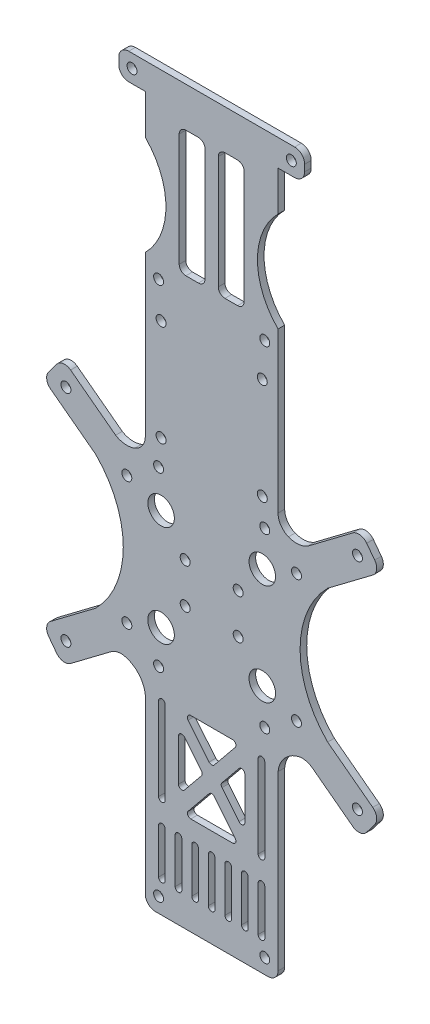
from build123d import *

# Parameters (mm, degrees)
CROQUIS1_R              = 4
CROQUIS1_R_2            = 1.5
SALIENTE_EXTRUIR1_DEPTH = 2
REDONDEO2_R             = 3
REDONDEO3_R             = 5
CROQUIS5_R              = 1.5
SALIENTE_EXTRUIR2_DEPTH = 2
CORTAR_EXTRUIR1_DEPTH   = 2


with BuildPart() as part:
    # Croquis1 → Saliente-Extruir1 (new body)
    with BuildSketch(Plane.XY):
        with BuildLine():
            Line((20, 130.25), (-20, 130.25))
            Line((-20, 130.25), (-20, 30.25))
            ThreePointArc((-20, 30.25), (-24.015805554, 27.30711153), (-28.936345286, 28.065778476))
            Line((-28.936345286, 28.065778476), (-44.909055487, 40.102078939))
            Line((-44.909055487, 40.102078939), (-47.918130603, 36.108901389))
            Line((-47.918130603, 36.108901389), (-50.927205719, 32.115723839))
            Line((-50.927205719, 32.115723839), (-34.954495518, 20.079423376))
            ThreePointArc((-34.954495518, 20.079423376), (-26.637326031, 0), (-34.954495518, -20.079423376))
            Line((-34.954495518, -20.079423376), (-50.927205719, -32.115723839))
            Line((-50.927205719, -32.115723839), (-47.918130603, -36.108901389))
            Line((-47.918130603, -36.108901389), (-44.909055487, -40.102078939))
            Line((-44.909055487, -40.102078939), (-28.936345286, -28.065778476))
            ThreePointArc((-28.936345286, -28.065778476), (-22.980271648, -29.80711153), (-20, -35.25))
            Line((-20, -35.25), (-20, -90.25))
            Line((-20, -90.25), (20, -90.25))
            Line((20, -90.25), (20, -35.25))
            ThreePointArc((20, -35.25), (22.980271648, -29.80711153), (28.936345286, -28.065778476))
            Line((28.936345286, -28.065778476), (44.909055487, -40.102078939))
            Line((44.909055487, -40.102078939), (47.918130603, -36.108901389))
            Line((47.918130603, -36.108901389), (50.927205719, -32.115723839))
            Line((50.927205719, -32.115723839), (34.954495518, -20.079423376))
            ThreePointArc((34.954495518, -20.079423376), (26.637326031, 0), (34.954495518, 20.079423376))
            Line((34.954495518, 20.079423376), (50.927205719, 32.115723839))
            Line((50.927205719, 32.115723839), (47.918130603, 36.108901389))
            Line((47.918130603, 36.108901389), (44.909055487, 40.102078939))
            Line((44.909055487, 40.102078939), (28.936345286, 28.065778476))
            ThreePointArc((28.936345286, 28.065778476), (24.015805554, 27.30711153), (20, 30.25))
            Line((20, 30.25), (20, 130.25))
        make_face()
        with Locations((-15.25, 15.25)):
            Circle(CROQUIS1_R, mode=Mode.SUBTRACT)
        with Locations((-15.25, -15.25)):
            Circle(CROQUIS1_R, mode=Mode.SUBTRACT)
        with Locations(Location((15.25, -15.25, 0), (0, 0, 180))):
            Circle(CROQUIS1_R, mode=Mode.SUBTRACT)
        with Locations(Location((15.25, 15.25, 0), (0, 0, 180))):
            Circle(CROQUIS1_R, mode=Mode.SUBTRACT)
        with Locations((-43.924953053, 33.099826273)):
            Circle(CROQUIS1_R_2, mode=Mode.SUBTRACT)
        with Locations((-43.924953053, -33.099826273)):
            Circle(CROQUIS1_R_2, mode=Mode.SUBTRACT)
        with Locations(Location((43.924953053, -33.099826273, 0), (0, 0, 180))):
            Circle(CROQUIS1_R_2, mode=Mode.SUBTRACT)
        with Locations(Location((43.924953053, 33.099826273, 0), (0, 0, 180))):
            Circle(CROQUIS1_R_2, mode=Mode.SUBTRACT)
        with Locations((-7.9863551, 6.018150232)):
            Circle(CROQUIS1_R_2, mode=Mode.SUBTRACT)
        with Locations((-25.560283405, 19.261055082)):
            Circle(CROQUIS1_R_2, mode=Mode.SUBTRACT)
        with Locations((-25.560283405, -19.261055082)):
            Circle(CROQUIS1_R_2, mode=Mode.SUBTRACT)
        with Locations((-7.9863551, -6.018150232)):
            Circle(CROQUIS1_R_2, mode=Mode.SUBTRACT)
        with Locations(Location((25.560283405, -19.261055082, 0), (0, 0, 180))):
            Circle(CROQUIS1_R_2, mode=Mode.SUBTRACT)
        with Locations(Location((7.9863551, -6.018150232, 0), (0, 0, 180))):
            Circle(CROQUIS1_R_2, mode=Mode.SUBTRACT)
        with Locations(Location((7.9863551, 6.018150232, 0), (0, 0, 180))):
            Circle(CROQUIS1_R_2, mode=Mode.SUBTRACT)
        with Locations(Location((25.560283405, 19.261055082, 0), (0, 0, 180))):
            Circle(CROQUIS1_R_2, mode=Mode.SUBTRACT)
        with Locations((-16, -85.75)):
            Circle(CROQUIS1_R_2, mode=Mode.SUBTRACT)
        with Locations((-16, -25.75)):
            Circle(CROQUIS1_R_2, mode=Mode.SUBTRACT)
        with Locations((-16, 26.25)):
            Circle(CROQUIS1_R_2, mode=Mode.SUBTRACT)
        with Locations((-16, 75.25)):
            Circle(CROQUIS1_R_2, mode=Mode.SUBTRACT)
        with Locations(Location((16, -85.75, 0), (0, 0, 180))):
            Circle(CROQUIS1_R_2, mode=Mode.SUBTRACT)
        with Locations(Location((16, -25.75, 0), (0, 0, 180))):
            Circle(CROQUIS1_R_2, mode=Mode.SUBTRACT)
        with Locations(Location((16, 26.25, 0), (0, 0, 180))):
            Circle(CROQUIS1_R_2, mode=Mode.SUBTRACT)
        with Locations(Location((16, 75.25, 0), (0, 0, 180))):
            Circle(CROQUIS1_R_2, mode=Mode.SUBTRACT)
        with Locations((-15.25, 64.75)):
            Circle(CROQUIS1_R_2, mode=Mode.SUBTRACT)
        with Locations((15.25, 64.75)):
            Circle(CROQUIS1_R_2, mode=Mode.SUBTRACT)
        with Locations((15.25, 34.25)):
            Circle(CROQUIS1_R_2, mode=Mode.SUBTRACT)
        with Locations((-15.25, 34.25)):
            Circle(CROQUIS1_R_2, mode=Mode.SUBTRACT)
        with BuildLine():
            Line((-11, -67.25), (-11, -80.75))
            ThreePointArc((-11, -80.75), (-10, -81.75), (-9, -80.75))
            Line((-9, -80.75), (-9, -67.25))
            ThreePointArc((-9, -67.25), (-10, -66.25), (-11, -67.25))
        make_face(mode=Mode.SUBTRACT)
        with BuildLine():
            Line((-16, -67.25), (-16, -80.75))
            ThreePointArc((-16, -80.75), (-15, -81.75), (-14, -80.75))
            Line((-14, -80.75), (-14, -67.25))
            ThreePointArc((-14, -67.25), (-15, -66.25), (-16, -67.25))
        make_face(mode=Mode.SUBTRACT)
        with BuildLine():
            Line((-6, -67.25), (-6, -80.75))
            ThreePointArc((-6, -80.75), (-5, -81.75), (-4, -80.75))
            Line((-4, -80.75), (-4, -67.25))
            ThreePointArc((-4, -67.25), (-5, -66.25), (-6, -67.25))
        make_face(mode=Mode.SUBTRACT)
        with BuildLine():
            Line((-1, -67.25), (-1, -80.75))
            ThreePointArc((-1, -80.75), (0, -81.75), (1, -80.75))
            Line((1, -80.75), (1, -67.25))
            ThreePointArc((1, -67.25), (0, -66.25), (-1, -67.25))
        make_face(mode=Mode.SUBTRACT)
        with BuildLine():
            Line((4, -67.25), (4, -80.75))
            ThreePointArc((4, -80.75), (5, -81.75), (6, -80.75))
            Line((6, -80.75), (6, -67.25))
            ThreePointArc((6, -67.25), (5, -66.25), (4, -67.25))
        make_face(mode=Mode.SUBTRACT)
        with BuildLine():
            Line((9, -67.25), (9, -80.75))
            ThreePointArc((9, -80.75), (10, -81.75), (11, -80.75))
            Line((11, -80.75), (11, -67.25))
            ThreePointArc((11, -67.25), (10, -66.25), (9, -67.25))
        make_face(mode=Mode.SUBTRACT)
        with BuildLine():
            Line((14, -67.25), (14, -80.75))
            ThreePointArc((14, -80.75), (15, -81.75), (16, -80.75))
            Line((16, -80.75), (16, -67.25))
            ThreePointArc((16, -67.25), (15, -66.25), (14, -67.25))
        make_face(mode=Mode.SUBTRACT)
        with BuildLine():
            Line((14, -34.75), (14, -59.75))
            ThreePointArc((14, -59.75), (15, -60.75), (16, -59.75))
            Line((16, -59.75), (16, -34.75))
            ThreePointArc((16, -34.75), (15, -33.75), (14, -34.75))
        make_face(mode=Mode.SUBTRACT)
        with BuildLine():
            Line((-16, -34.75), (-16, -59.75))
            ThreePointArc((-16, -59.75), (-15, -60.75), (-14, -59.75))
            Line((-14, -59.75), (-14, -34.75))
            ThreePointArc((-14, -34.75), (-15, -33.75), (-16, -34.75))
        make_face(mode=Mode.SUBTRACT)
    extrude(amount=SALIENTE_EXTRUIR1_DEPTH)

    # Redondeo2
    redondeo2_edges = [part.edges().sort_by_distance(p)[0] for p in [
        (44.909055487, 40.102078939, 1),
        (50.927205719, 32.115723839, 1),
        (50.927205719, -32.115723839, 1),
        (44.909055487, -40.102078939, 1),
        (20, -90.25, 1),
        (-20, -90.25, 1),
        (-44.909055487, -40.102078939, 1),
        (-50.927205719, -32.115723839, 1),
        (-50.927205719, 32.115723839, 1),
        (-44.909055487, 40.102078939, 1),
    ]]
    fillet(redondeo2_edges, radius=REDONDEO2_R)

    # Redondeo3
    redondeo3_edges = [part.edges().sort_by_distance(p)[0] for p in [
        (20, 30.25, 1),
        (28.936345286, -28.065778476, 1),
        (-28.936345286, -28.065778476, 1),
        (-20, 30.25, 1),
    ]]
    fillet(redondeo3_edges, radius=REDONDEO3_R)

    # Croquis5 → Saliente-Extruir2 (add)
    # profile 1 of 2: a face of its own
    with BuildSketch(Plane.XY.offset(2)):
        with BuildLine():
            Line((-20, 130.25), (-25, 130.25))
            ThreePointArc((-25, 130.25), (-27.121320344, 129.371320344), (-28, 127.25))
            Line((-28, 127.25), (-28, 125.25))
            ThreePointArc((-28, 125.25), (-27.121320344, 123.128679656), (-25, 122.25))
            Line((-25, 122.25), (-20, 122.25))
            Line((-20, 122.25), (-20, 130.25))
        make_face()
        with Locations((-24, 126.25)):
            Circle(CROQUIS5_R, mode=Mode.SUBTRACT)
    # profile 2 of 2: a face of its own
    with BuildSketch(Plane.XY.offset(2)):
        with BuildLine():
            Line((28, 127.25), (28, 125.25))
            ThreePointArc((28, 125.25), (27.121320344, 123.128679656), (25, 122.25))
            Line((25, 122.25), (20, 122.25))
            Line((20, 122.25), (20, 130.25))
            Line((20, 130.25), (25, 130.25))
            ThreePointArc((25, 130.25), (27.121320344, 129.371320344), (28, 127.25))
        make_face()
        with Locations(Location((24, 126.25, 0), (0, 0, 180))):
            Circle(CROQUIS5_R, mode=Mode.SUBTRACT)
    extrude(amount=-SALIENTE_EXTRUIR2_DEPTH)

    # Croquis6 → Cortar-Extruir1 (cut)
    with BuildSketch(Plane.XY.offset(2)):
        with BuildLine():
            Line((-20, 110.25), (-20, 80.25))
            ThreePointArc((-20, 80.25), (-13.786796564, 95.25), (-20, 110.25))
        make_face()
        with BuildLine():
            Line((20, 110.25), (20, 80.25))
            ThreePointArc((20, 80.25), (13.786796564, 95.25), (20, 110.25))
        make_face()
        with BuildLine():
            Line((-8.224765014, -40.322165622), (-3.094559407, -46.618327049))
            ThreePointArc((-3.094559407, -46.618327049), (-2.869794393, -47.25), (-3.094559407, -47.881672951))
            Line((-3.094559407, -47.881672951), (-8.224765014, -54.177834378))
            ThreePointArc((-8.224765014, -54.177834378), (-9.335235003, -54.488295968), (-10, -53.546161427))
            Line((-10, -53.546161427), (-10, -40.953838573))
            ThreePointArc((-10, -40.953838573), (-9.335235003, -40.011704032), (-8.224765014, -40.322165622))
        make_face()
        with BuildLine():
            Line((10, -53.546161427), (10, -40.953838573))
            ThreePointArc((10, -40.953838573), (9.335235003, -40.011704032), (8.224765014, -40.322165622))
            Line((8.224765014, -40.322165622), (3.094559407, -46.618327049))
            ThreePointArc((3.094559407, -46.618327049), (2.869794393, -47.25), (3.094559407, -47.881672951))
            Line((3.094559407, -47.881672951), (8.224765014, -54.177834378))
            ThreePointArc((8.224765014, -54.177834378), (9.335235003, -54.488295968), (10, -53.546161427))
        make_face()
        with BuildLine():
            Line((-7.090625778, -35.381672951), (-0.775234986, -43.132379833))
            ThreePointArc((-0.775234986, -43.132379833), (0, -43.500706882), (0.775234986, -43.132379833))
            Line((0.775234986, -43.132379833), (7.090625778, -35.381672951))
            ThreePointArc((7.090625778, -35.381672951), (7.218627459, -34.320857221), (6.315390792, -33.75))
            Line((6.315390792, -33.75), (-6.315390792, -33.75))
            ThreePointArc((-6.315390792, -33.75), (-7.218627459, -34.320857221), (-7.090625778, -35.381672951))
        make_face()
        with BuildLine():
            Line((0.775234986, -51.367620167), (7.090625778, -59.118327049))
            ThreePointArc((7.090625778, -59.118327049), (7.218627459, -60.179142779), (6.315390792, -60.75))
            Line((6.315390792, -60.75), (-6.315390792, -60.75))
            ThreePointArc((-6.315390792, -60.75), (-7.218627459, -60.179142779), (-7.090625778, -59.118327049))
            Line((-7.090625778, -59.118327049), (-0.775234986, -51.367620167))
            ThreePointArc((-0.775234986, -51.367620167), (0, -50.999293118), (0.775234986, -51.367620167))
        make_face()
        with BuildLine():
            Line((2, 116.25), (2, 82.25))
            ThreePointArc((2, 82.25), (2.585786438, 80.835786438), (4, 80.25))
            Line((4, 80.25), (7.786796564, 80.25))
            ThreePointArc((7.786796564, 80.25), (9.201010127, 80.835786438), (9.786796564, 82.25))
            Line((9.786796564, 82.25), (9.786796564, 116.25))
            ThreePointArc((9.786796564, 116.25), (9.201010127, 117.664213562), (7.786796564, 118.25))
            Line((7.786796564, 118.25), (4, 118.25))
            ThreePointArc((4, 118.25), (2.585786438, 117.664213562), (2, 116.25))
        make_face()
        with BuildLine():
            Line((-7.786796564, 118.25), (-4, 118.25))
            ThreePointArc((-4, 118.25), (-2.585786438, 117.664213562), (-2, 116.25))
            Line((-2, 116.25), (-2, 82.25))
            ThreePointArc((-2, 82.25), (-2.585786438, 80.835786438), (-4, 80.25))
            Line((-4, 80.25), (-7.786796564, 80.25))
            ThreePointArc((-7.786796564, 80.25), (-9.201010127, 80.835786438), (-9.786796564, 82.25))
            Line((-9.786796564, 82.25), (-9.786796564, 116.25))
            ThreePointArc((-9.786796564, 116.25), (-9.201010127, 117.664213562), (-7.786796564, 118.25))
        make_face()
    extrude(amount=-CORTAR_EXTRUIR1_DEPTH, mode=Mode.SUBTRACT)


solid = part.part
